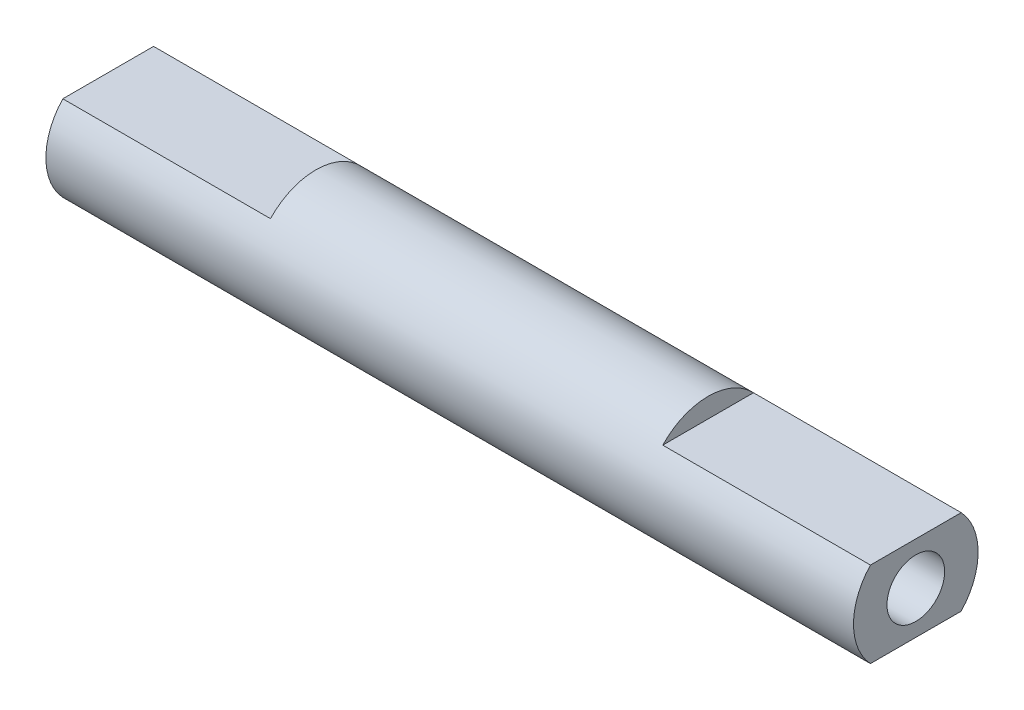
from build123d import *

# Parameters (mm, degrees)
SKETCH1_R               = 2.7
BOSS_EXTRUDE1_DEPTH     = 35
CUT_EXTRUDE1_DEPTH      = 36.207669619
CUT_EXTRUDE1_DEPTH_BACK = 36.207669619
SKETCH2_W               = 9
SKETCH2_H               = 0.85
M3_TAPPED_HOLE1_D       = 2.5
M3_TAPPED_HOLE1_DEPTH   = 7.5
M3_TAPPED_HOLE1_TIP     = 0.751075774


with BuildPart() as part:
    # Sketch1 → Boss-Extrude1 (new body)
    with BuildSketch(Plane(origin=(0, 0, 0), x_dir=(0, 0, -1), z_dir=(1, 0, 0))):
        Circle(SKETCH1_R)
    extrude(amount=BOSS_EXTRUDE1_DEPTH)

    # Sketch2 → Cut-Extrude1 (cut, two sides: drawn at the far end of the back side and taken through both)
    with BuildSketch(Plane.XY.offset(-CUT_EXTRUDE1_DEPTH_BACK)):
        with Locations((30.5, 2.275)):
            Rectangle(SKETCH2_W, SKETCH2_H)
        with Locations((30.5, -2.275)):
            Rectangle(SKETCH2_W, SKETCH2_H)
        with Locations((4.5, -2.275)):
            Rectangle(SKETCH2_W, SKETCH2_H)
        with Locations((4.5, 2.275)):
            Rectangle(SKETCH2_W, SKETCH2_H)
    extrude(amount=CUT_EXTRUDE1_DEPTH + CUT_EXTRUDE1_DEPTH_BACK, mode=Mode.SUBTRACT)

    # M3 Tapped Hole1
    with Locations(Plane(origin=(35, 0, 0), x_dir=(0, 0, -1), z_dir=(1, 0, 0))):
        with Locations((0, 0)):
            Hole(M3_TAPPED_HOLE1_D / 2, depth=M3_TAPPED_HOLE1_DEPTH)
            with Locations((0, 0, -(M3_TAPPED_HOLE1_DEPTH + M3_TAPPED_HOLE1_TIP / 2))):  # 118° drill point
                Cone(0, M3_TAPPED_HOLE1_D / 2, M3_TAPPED_HOLE1_TIP, mode=Mode.SUBTRACT)


solid = part.part
